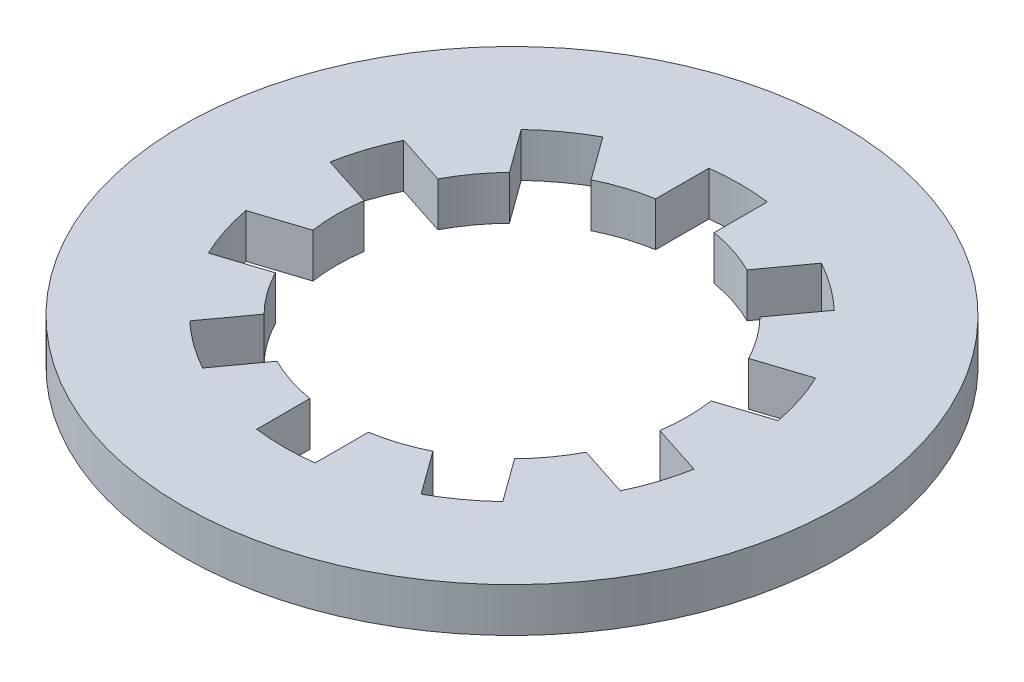
from build123d import *

# Parameters (mm, degrees)
SKETCH1_R          = 9.4996
SKETCH1_R_2        = 5.0546
EXTRUDE1_DEPTH     = 1.27
CUT_EXTRUDE1_DEPTH = 14.494358092
CIRPATTERN1_COUNT  = 10


with BuildPart() as part:
    # Sketch1 → Extrude1 (new body)
    with BuildSketch(Plane(origin=(0, 0, 0), x_dir=(1, 0, 0), z_dir=(0, 1, 0))):
        Circle(SKETCH1_R)
        Circle(SKETCH1_R_2, mode=Mode.SUBTRACT)
    extrude(amount=EXTRUDE1_DEPTH)

    # Sketch2 → Cut-Extrude1 (cut, through all)
    with BuildSketch(Plane(origin=(0, 1.27, 0), x_dir=(-1, 0, 0), z_dir=(0, 1, 0))):
        with BuildLine():
            Line((-0.842433333, 6.516754118), (-0.842433333, 4.983902812))
            ThreePointArc((-0.842433333, 4.983902812), (0, 5.0546), (0.842433333, 4.983902812))
            Line((0.842433333, 4.983902812), (0.842433333, 6.516754118))
            ThreePointArc((0.842433333, 6.516754118), (0, 6.57098), (-0.842433333, 6.516754118))
        make_face()
    cut_extrude1 = extrude(amount=-CUT_EXTRUDE1_DEPTH, mode=Mode.SUBTRACT)

    # CirPattern1: Cut-Extrude1 ×10 about axis
    cirpattern1_axis = Axis((0, 8.866745684, 0), (0, -1, 0))
    for i in range(1, CIRPATTERN1_COUNT):
        add(cut_extrude1.rotate(cirpattern1_axis, i * 360 / CIRPATTERN1_COUNT), mode=Mode.SUBTRACT)


solid = part.part
